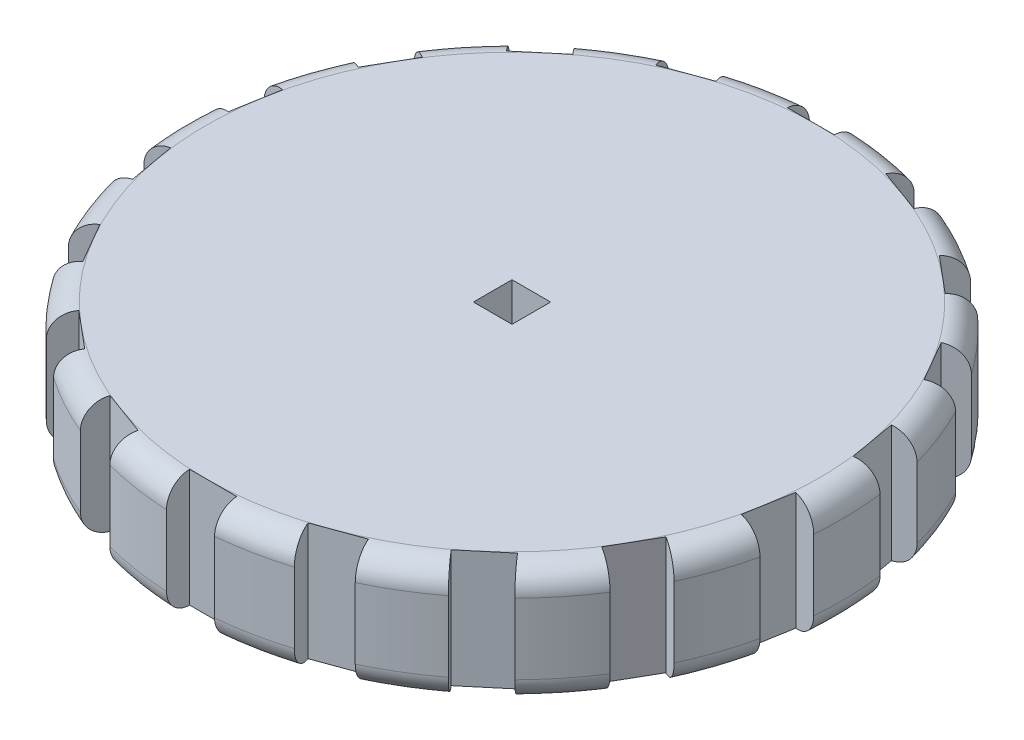
from build123d import *

# Parameters (mm, degrees)
SKETCH_1_R          = 7
EXTRUDE_1_DEPTH     = 2.5
SKETCH_3_R          = 2
EXTRUDE_3_DEPTH     = 1.5
FILLET_2_R          = 0.5
SKETCH_4_W          = 1
SKETCH_4_H          = 1.5
CUT_EXTRUDE_1_DEPTH = 10
SKETCH_2_W          = 0.82
SKETCH_2_H          = 0.82
CUT_EXTRUDE_2_DEPTH = 2.5


with BuildPart() as part:
    # 草图1 → 凸台-拉伸1 (new body)
    with BuildSketch(Plane(origin=(0, 0, 0), x_dir=(1, 0, 0), z_dir=(0, 1, 0))):
        with Locations(Location((-28.569838241, 1.786718145, 0), (0, 0, 270))):
            Circle(SKETCH_1_R)
    extrude(amount=EXTRUDE_1_DEPTH)

    # 草图3 → 凸台-拉伸3 (add)
    with BuildSketch(Plane.XZ):
        with Locations(Location((-28.569838241, -1.786718145, 0), (0, 0, 270))):
            Circle(SKETCH_3_R)
    extrude(amount=EXTRUDE_3_DEPTH)

    # 圆角2
    fillet_2_edges = [part.edges().sort_by_distance(p)[0] for p in [
        (-28.569838241, 0, -8.786718145),
        (-28.569838241, 2.5, -8.786718145),
    ]]
    fillet(fillet_2_edges, radius=FILLET_2_R)

    # 草图4 → 切除-拉伸1 (cut)
    with BuildSketch(Plane(origin=(0, 2.5, 0), x_dir=(1, 0, 0), z_dir=(0, 1, 0))):
        with Locations((-28.417730855, -5.463281855)):
            Rectangle(SKETCH_4_W, SKETCH_4_H)
        Polygon((-31.119881294, -4.202297609), (-31.632911509, -5.61183654), (-30.693218889, -5.953856683), (-30.180188674, -4.544317752), align=None)
        Polygon((-33.014458907, -2.968949674), (-33.978640322, -4.118016339), (-33.212595879, -4.760803949), (-32.248414464, -3.611737284), align=None)
        Polygon((-34.372949672, -1.161998014), (-35.671987778, -1.911998014), (-35.171987778, -2.778023418), (-33.872949672, -2.028023418), align=None)
        Polygon((-35.031499554, 1.000612333), (-36.508711183, 0.740140066), (-36.335063006, -0.244667687), (-34.857851376, 0.01580458), align=None)
        Polygon((-34.910677717, 3.258038642), (-36.387889347, 3.518510909), (-36.561537524, 2.533703156), (-35.084325895, 2.273230889), align=None)
        Polygon((-34.025057059, 5.338001986), (-35.324095165, 6.088001986), (-35.824095165, 5.221976582), (-34.525057059, 4.471976582), align=None)
        Polygon((-32.481456501, 6.989628086), (-33.445637915, 8.138694751), (-34.211682358, 7.495907141), (-33.247500944, 6.346840477), align=None)
        Polygon((-30.466057051, 8.013706461), (-30.979087266, 9.423245392), (-31.918779887, 9.081225249), (-31.405749672, 7.671686318), align=None)
        with Locations((-28.721945627, 9.036718145)):
            Rectangle(SKETCH_4_W, SKETCH_4_H)
        Polygon((-26.019795188, 7.775733898), (-25.506764973, 9.185272829), (-26.446457593, 9.527292973), (-26.959487808, 8.117754041), align=None)
        Polygon((-24.125217575, 6.542385963), (-23.16103616, 7.691452628), (-23.927080603, 8.334240238), (-24.891262018, 7.185173573), align=None)
        Polygon((-22.76672681, 4.735434303), (-21.467688704, 5.485434303), (-21.967688704, 6.351459707), (-23.26672681, 5.601459707), align=None)
        Polygon((-22.108176928, 2.572823956), (-20.630965299, 2.833296223), (-20.804613476, 3.818103976), (-22.281825106, 3.557631709), align=None)
        Polygon((-22.228998765, 0.315397647), (-20.751787135, 0.05492538), (-20.578138958, 1.039733133), (-22.055350587, 1.3002054), align=None)
        Polygon((-23.114619423, -1.764565697), (-21.815581318, -2.514565697), (-21.315581318, -1.648540293), (-22.614619423, -0.898540293), align=None)
        Polygon((-24.658219981, -3.416191797), (-23.694038567, -4.565258462), (-22.927994124, -3.922470852), (-23.892175538, -2.773404187), align=None)
        Polygon((-26.673619431, -4.440270172), (-26.160589216, -5.849809103), (-25.220896595, -5.50778896), (-25.73392681, -4.098250029), align=None)
    extrude(amount=-CUT_EXTRUDE_1_DEPTH, mode=Mode.SUBTRACT)

    # 草图2 → 切除-拉伸2 (cut)
    with BuildSketch(Plane(origin=(0, 2.5, 0), x_dir=(1, 0, 0), z_dir=(0, 1, 0))):
        with Locations((-28.569838241, 1.786718145)):
            Rectangle(SKETCH_2_W, SKETCH_2_H)
    extrude(amount=-CUT_EXTRUDE_2_DEPTH, mode=Mode.SUBTRACT)


solid = part.part
